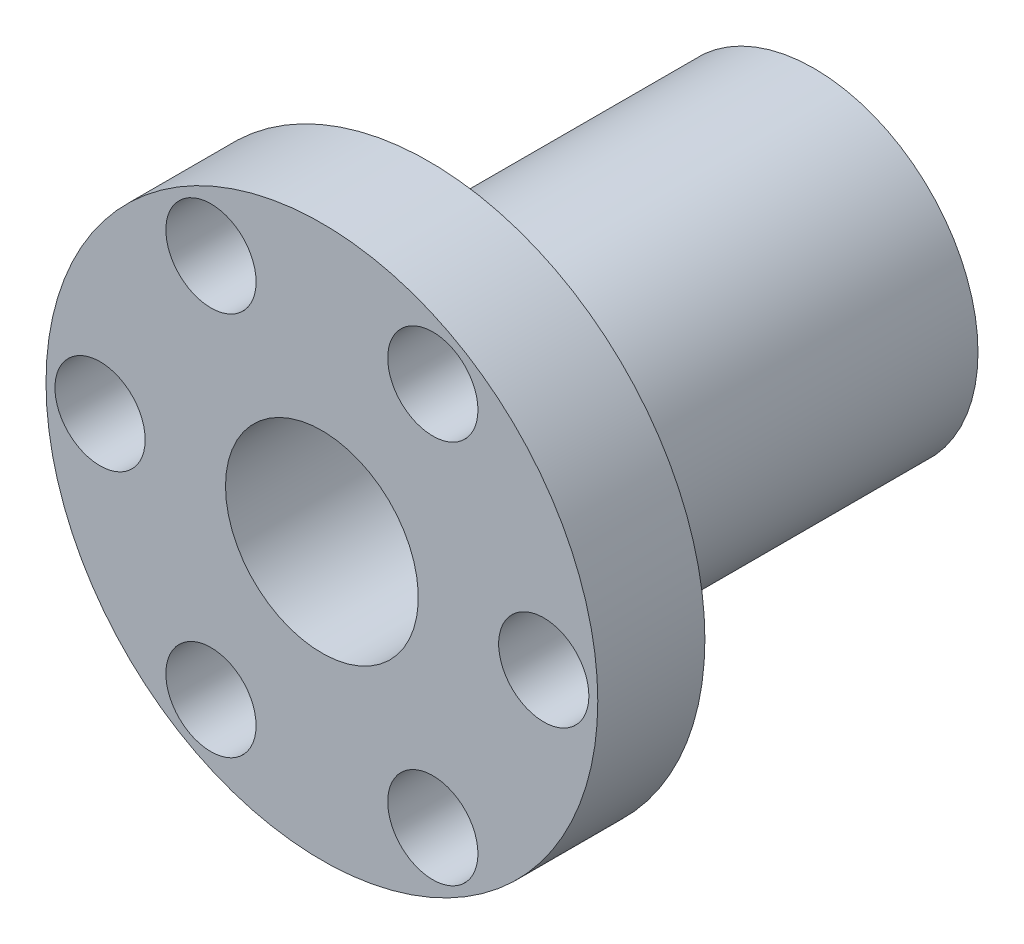
from build123d import *

# Parameters (mm, degrees)
ESBO_O1_R                = 28.62
RESSALTO_EXTRUS_O1_DEPTH = 11.11
ESBO_O2_R                = 17
RESSALTO_EXTRUS_O2_DEPTH = 39.95
ESBO_O3_R                = 10
CORTE_EXTRUS_O1_DEPTH    = 66.15621536
ESBO_O6_R                = 2.75
CORTE_EXTRUS_O3_DEPTH    = 11.11
CORTE_EXTRUS_O2_START    = 4.39
ESBO_O4_R                = 4.68
CORTE_EXTRUS_O2_DEPTH    = 53.480126604


with BuildPart() as part:
    # Esboço1 → Ressalto-extrusão1 (new body)
    with BuildSketch(Plane.XY):
        Circle(ESBO_O1_R)
    extrude(amount=RESSALTO_EXTRUS_O1_DEPTH)

    # Esboço2 → Ressalto-extrusão2 (add)
    with BuildSketch(Plane(origin=(0, 0, 0), x_dir=(-1, 0, 0), z_dir=(0, 0, -1))):
        with Locations(Location((0, 0, 0), (0, 0, 180))):
            Circle(ESBO_O2_R)
    extrude(amount=RESSALTO_EXTRUS_O2_DEPTH)

    # Esboço3 → Corte-extrusão1 (cut, through all)
    with BuildSketch(Plane(origin=(0, 0, -39.95), x_dir=(-1, 0, 0), z_dir=(0, 0, -1))):
        Circle(ESBO_O3_R)
    extrude(amount=-CORTE_EXTRUS_O1_DEPTH, mode=Mode.SUBTRACT)

    # Esboço6 → Corte-extrusão3 (cut)
    with BuildSketch(Plane.XY.offset(11.11)):
        with Locations((23.015, 0)):
            Circle(ESBO_O6_R)
        with Locations((11.5075, -19.931574668)):
            Circle(ESBO_O6_R)
        with Locations((-11.5075, -19.931574668)):
            Circle(ESBO_O6_R)
        with Locations((-23.015, 0)):
            Circle(ESBO_O6_R)
        with Locations((-11.5075, 19.931574668)):
            Circle(ESBO_O6_R)
        with Locations((11.5075, 19.931574668)):
            Circle(ESBO_O6_R)
    extrude(amount=-CORTE_EXTRUS_O3_DEPTH, mode=Mode.SUBTRACT)

    # Esboço4 → Corte-extrusão2 (cut, through all)
    with BuildSketch(Plane.XY.offset(CORTE_EXTRUS_O2_START)):
        with Locations((23.015, 0)):
            Circle(ESBO_O4_R)
        with Locations((11.5075, -19.931574668)):
            Circle(ESBO_O4_R)
        with Locations((-11.5075, -19.931574668)):
            Circle(ESBO_O4_R)
        with Locations((-23.015, 0)):
            Circle(ESBO_O4_R)
        with Locations((-11.5075, 19.931574668)):
            Circle(ESBO_O4_R)
        with Locations((11.5075, 19.931574668)):
            Circle(ESBO_O4_R)
    extrude(amount=CORTE_EXTRUS_O2_DEPTH, mode=Mode.SUBTRACT)


solid = part.part
